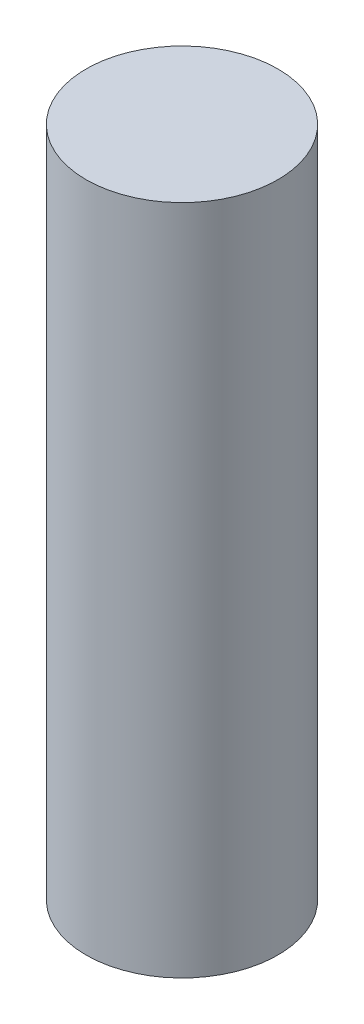
from build123d import *

# Parameters (mm, degrees)
SCHIZZO1_R                   = 1
ESTRUSIONE_ESTRUSIONE1_DEPTH = 7


with BuildPart() as part:
    # Schizzo1 → Estrusione-Estrusione1 (new body)
    with BuildSketch(Plane(origin=(0, 0, 0), x_dir=(1, 0, 0), z_dir=(0, 1, 0))):
        with Locations(Location((-6.930435816, 2.145972511, 0), (0, 0, 270))):
            Circle(SCHIZZO1_R)
    extrude(amount=ESTRUSIONE_ESTRUSIONE1_DEPTH)


solid = part.part
